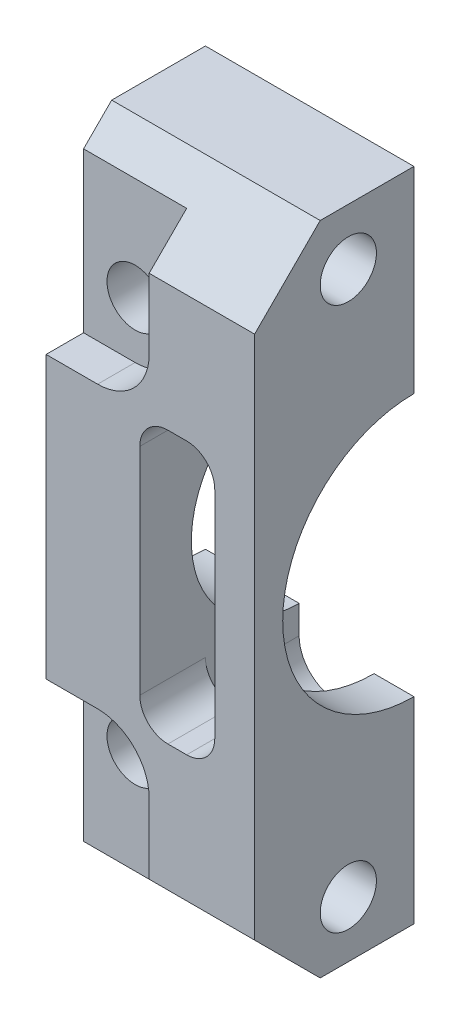
from build123d import *

# Parameters (mm, degrees)
BOSS_EXTRUDE1_DEPTH = 10
BOSS_EXTRUDE2_DEPTH = 12.25
SKETCH3_W           = 22.25
SKETCH3_H           = 8
CUT_EXTRUDE1_DEPTH  = 80
SKETCH8_R           = 3
CUT_EXTRUDE4_DEPTH  = 25
CUT_EXTRUDE2_DEPTH  = 10
SKETCH7_W           = 8
SKETCH7_H           = 29
CUT_EXTRUDE3_DEPTH  = 10
FILLET1_R           = 3
SKETCH19_R          = 3
CUT_EXTRUDE5_DEPTH  = 20
SKETCH21_W          = 4
SKETCH21_H          = 20
CUT_EXTRUDE6_DEPTH  = 11
FILLET2_R           = 5.5
CHAMFER1_SIZE       = 7


with BuildPart() as part:
    # Sketch1 → Boss-Extrude1 (new body)
    with BuildSketch(Plane(origin=(0, 0, 0), x_dir=(0, 0, -1), z_dir=(1, 0, 0))):
        with BuildLine():
            Line((0, 11.5), (0, 35))
            Line((0, 35), (-25, 35))
            Line((-25, 35), (-25, -35))
            Line((-25, -35), (0, -35))
            Line((0, -35), (0, -11.5))
            ThreePointArc((0, -11.5), (-11.5, 0), (0, 11.5))
        make_face()
    extrude(amount=BOSS_EXTRUDE1_DEPTH)

    # Sketch2 → Boss-Extrude2 (add)
    with BuildSketch(Plane(origin=(10, 0, 0), x_dir=(0, 0, -1), z_dir=(1, 0, 0))):
        with BuildLine():
            Line((0, -14), (0, -35))
            Line((0, -35), (-25, -35))
            Line((-25, -35), (-25, 35))
            Line((-25, 35), (0, 35))
            Line((0, 35), (0, 14))
            ThreePointArc((0, 14), (-14, 0), (0, -14))
        make_face()
    extrude(amount=BOSS_EXTRUDE2_DEPTH)

    # Sketch3 → Cut-Extrude1 (cut)
    with BuildSketch(Plane.XZ.offset(35)):
        with Locations((11.125, 21)):
            Rectangle(SKETCH3_W, SKETCH3_H)
    extrude(amount=-CUT_EXTRUDE1_DEPTH, mode=Mode.SUBTRACT)

    # Sketch8 → Cut-Extrude4 (cut)
    with BuildSketch(Plane(origin=(22.25, 0, 0), x_dir=(0, 0, -1), z_dir=(1, 0, 0))):
        with Locations((-7, -29)):
            Circle(SKETCH8_R)
        with Locations((-7, 29)):
            Circle(SKETCH8_R)
    extrude(amount=-CUT_EXTRUDE4_DEPTH, mode=Mode.SUBTRACT)

    # Sketch6 → Cut-Extrude2 (cut)
    with BuildSketch(Plane(origin=(0, 0, 0), x_dir=(-1, 0, 0), z_dir=(0, 0, -1))):
        with BuildLine():
            Line((-18, -14.5), (-18, 14.5))
            ThreePointArc((-18, 14.5), (-14, 18.5), (-10, 14.5))
            Line((-10, 14.5), (-10, -14.5))
            ThreePointArc((-10, -14.5), (-14, -18.5), (-18, -14.5))
        make_face()
    extrude(amount=-CUT_EXTRUDE2_DEPTH, mode=Mode.SUBTRACT)

    # Sketch7 → Cut-Extrude3 (cut)
    with BuildSketch(Plane(origin=(0, 0, 10), x_dir=(-1, 0, 0), z_dir=(0, 0, -1))):
        with Locations((-14, 0)):
            Rectangle(SKETCH7_W, SKETCH7_H)
    extrude(amount=-CUT_EXTRUDE3_DEPTH, mode=Mode.SUBTRACT)

    # Fillet1
    fillet1_edges = [part.edges().sort_by_distance(p)[0] for p in [
        (18, 14.5, 13.5),
        (18, -14.5, 13.5),
        (10, 14.5, 13.5),
        (10, -14.5, 13.5),
    ]]
    fillet(fillet1_edges, radius=FILLET1_R)

    # Sketch19 → Cut-Extrude5 (cut)
    with BuildSketch(Plane(origin=(0, 0, 0), x_dir=(-1, 0, 0), z_dir=(0, 0, -1))):
        with Locations(Location((-5.5, -21, 0), (0, 0, 90))):
            Circle(SKETCH19_R)
        with Locations(Location((-5.5, 21, 0), (0, 0, 90))):
            Circle(SKETCH19_R)
    extrude(amount=-CUT_EXTRUDE5_DEPTH, mode=Mode.SUBTRACT)

    # Sketch21 → Cut-Extrude6 (cut)
    with BuildSketch(Plane.ZY):
        with Locations((15, -25)):
            Rectangle(SKETCH21_W, SKETCH21_H)
        with Locations((15, 25)):
            Rectangle(SKETCH21_W, SKETCH21_H)
    extrude(amount=-CUT_EXTRUDE6_DEPTH, mode=Mode.SUBTRACT)

    # Fillet2
    fillet2_edges = [part.edges().sort_by_distance(p)[0] for p in [
        (11, -15, 15),
        (11, 15, 15),
    ]]
    fillet(fillet2_edges, radius=FILLET2_R)

    # Chamfer1
    chamfer1_edges = [part.edges().sort_by_distance(p)[0] for p in [
        (16.625, -35, 17),
        (16.625, 35, 17),
    ]]
    chamfer(chamfer1_edges, length=CHAMFER1_SIZE)


solid = part.part
